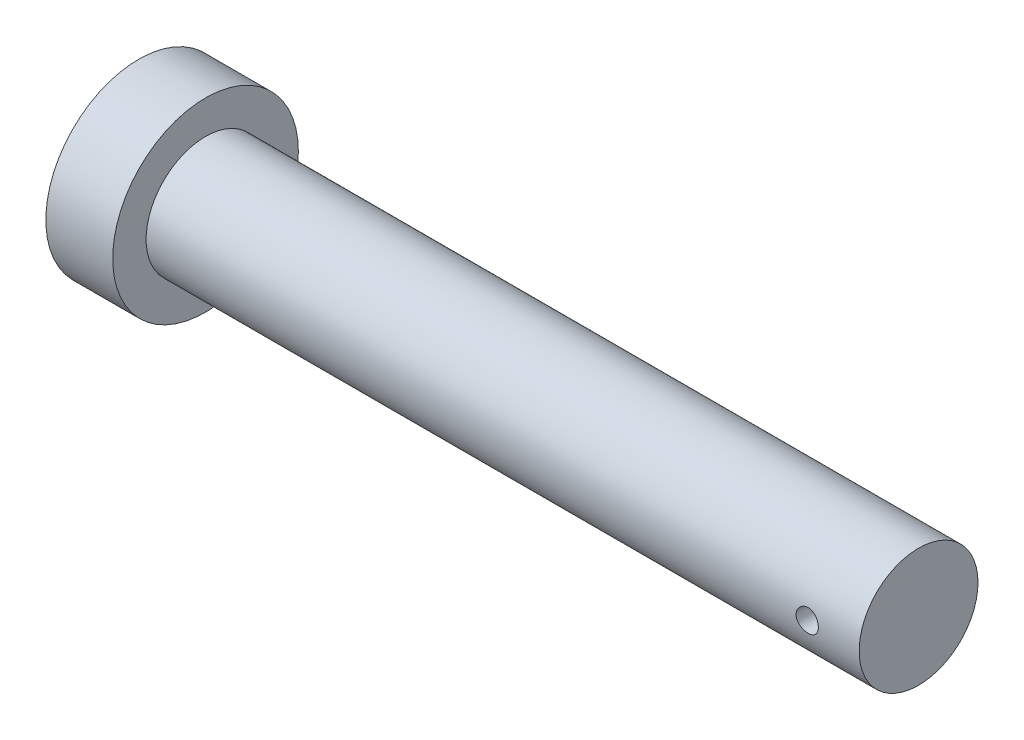
from build123d import *

# Parameters (mm, degrees)
SKETCH1_R           = 12.5
BOSS_EXTRUDE1_DEPTH = 9
SKETCH2_R           = 8
BOSS_EXTRUDE2_DEPTH = 96
SKETCH4_R           = 1.5
CUT_EXTRUDE1_DEPTH  = 96
ESCALA1_SCALE       = 0.5


with BuildPart() as part:
    # Sketch1 → Boss-Extrude1 (new body)
    with BuildSketch(Plane(origin=(0, 0, 0), x_dir=(0, 0, -1), z_dir=(1, 0, 0))):
        Circle(SKETCH1_R)
    extrude(amount=BOSS_EXTRUDE1_DEPTH)

    # Sketch2 → Boss-Extrude2 (add)
    with BuildSketch(Plane(origin=(9, 0, 0), x_dir=(0, 0, -1), z_dir=(1, 0, 0))):
        Circle(SKETCH2_R)
    extrude(amount=BOSS_EXTRUDE2_DEPTH)

    # Sketch4 → Cut-Extrude1 (cut)
    with BuildSketch(Plane.XY.offset(8)):
        with Locations((98, 0)):
            Circle(SKETCH4_R)
    extrude(amount=-CUT_EXTRUDE1_DEPTH, mode=Mode.SUBTRACT)


with BuildPart() as part_1:
    # Escala1: scaled about (46.97958084, -3.1e-08, 3.35e-07)
    add(part.part.scale(ESCALA1_SCALE).moved(Location((23.48979042, -1.5e-08, 1.68e-07))))


solid = part_1.part
